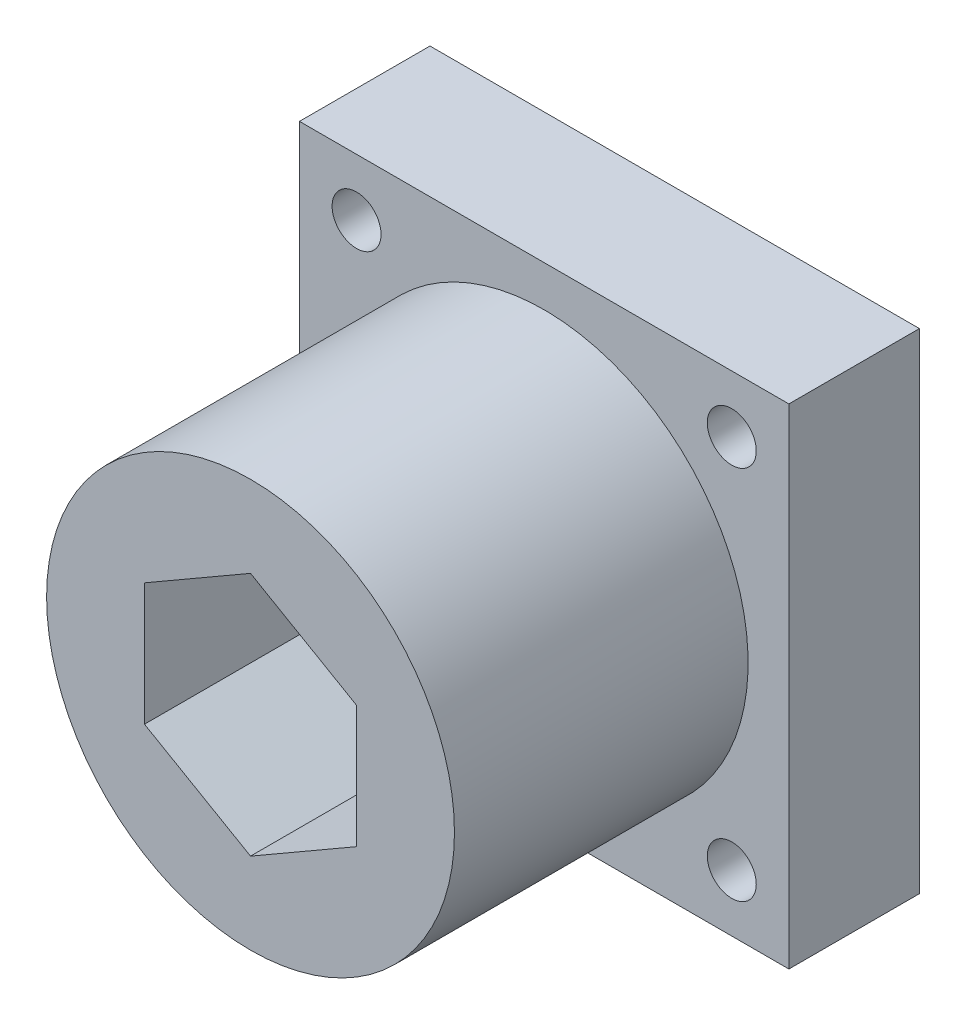
from build123d import *

# Parameters (mm, degrees)
IZIM1_W                     = 30
IZIM1_H                     = 30
Y_KSEKLIK_EKSTR_ZYON1_DEPTH = 8
IZIM2_R                     = 12.5
Y_KSEKLIK_EKSTR_ZYON2_DEPTH = 8
IZIM3_R                     = 5.5
KES_EKSTR_ZYON1_DEPTH       = 8
IZIM4_R                     = 1.5
KES_EKSTR_ZYON2_DEPTH       = 8
IZIM5_R                     = 12.5
Y_KSEKLIK_EKSTR_ZYON3_DEPTH = 10


with BuildPart() as part:
    # Çizim1 → Yükseklik-Ekstrüzyon1 (new body)
    with BuildSketch(Plane.XY):
        with Locations((15, 15)):
            Rectangle(IZIM1_W, IZIM1_H)
    extrude(amount=Y_KSEKLIK_EKSTR_ZYON1_DEPTH)

    # Çizim2 → Yükseklik-Ekstrüzyon2 (add)
    with BuildSketch(Plane.XY.offset(8)):
        with Locations(Location((15, 15, 0), (0, 0, 180))):
            Circle(IZIM2_R)
        Polygon((15, 22.505553499), (8.5, 18.75277675), (8.5, 11.24722325), (15, 7.494446501), (21.5, 11.24722325), (21.5, 18.75277675), align=None, mode=Mode.SUBTRACT)
    extrude(amount=Y_KSEKLIK_EKSTR_ZYON2_DEPTH)

    # Çizim3 → Kes-Ekstrüzyon1 (cut)
    with BuildSketch(Plane.XY.offset(8)):
        with Locations((15, 15)):
            Circle(IZIM3_R)
    extrude(amount=-KES_EKSTR_ZYON1_DEPTH, mode=Mode.SUBTRACT)

    # Çizim4 → Kes-Ekstrüzyon2 (cut)
    with BuildSketch(Plane.XY.offset(8)):
        with Locations((3.5, 26.5)):
            Circle(IZIM4_R)
        with Locations((26.5, 26.5)):
            Circle(IZIM4_R)
        with Locations((26.5, 3.5)):
            Circle(IZIM4_R)
        with Locations((3.5, 3.5)):
            Circle(IZIM4_R)
    extrude(amount=-KES_EKSTR_ZYON2_DEPTH, mode=Mode.SUBTRACT)

    # Çizim5 → Yükseklik-Ekstrüzyon3 (add)
    with BuildSketch(Plane.XY.offset(16)):
        with Locations(Location((15, 15, 0), (0, 0, 180))):
            Circle(IZIM5_R)
        Polygon((15, 22.505553499), (8.5, 18.75277675), (8.5, 11.24722325), (15, 7.494446501), (21.5, 11.24722325), (21.5, 18.75277675), align=None, mode=Mode.SUBTRACT)
    extrude(amount=Y_KSEKLIK_EKSTR_ZYON3_DEPTH)


solid = part.part
